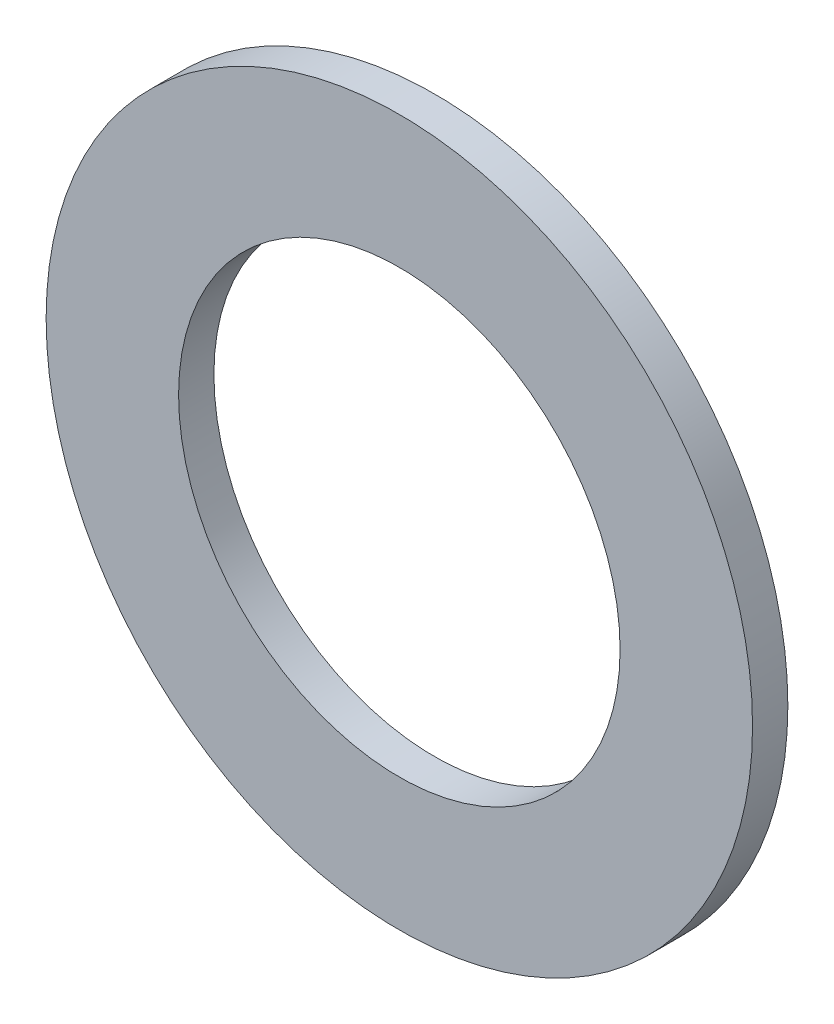
from build123d import *

# Parameters (mm, degrees)
ESQUISSE1_R          = 40
ESQUISSE1_R_2        = 25
BASE_EXTRUSION_DEPTH = 2


with BuildPart() as part:
    # Esquisse1 → Base-Extrusion (new, symmetric)
    with BuildSketch(Plane.XY):
        Circle(ESQUISSE1_R)
        Circle(ESQUISSE1_R_2, mode=Mode.SUBTRACT)
    extrude(amount=BASE_EXTRUSION_DEPTH, both=True)


solid = part.part
